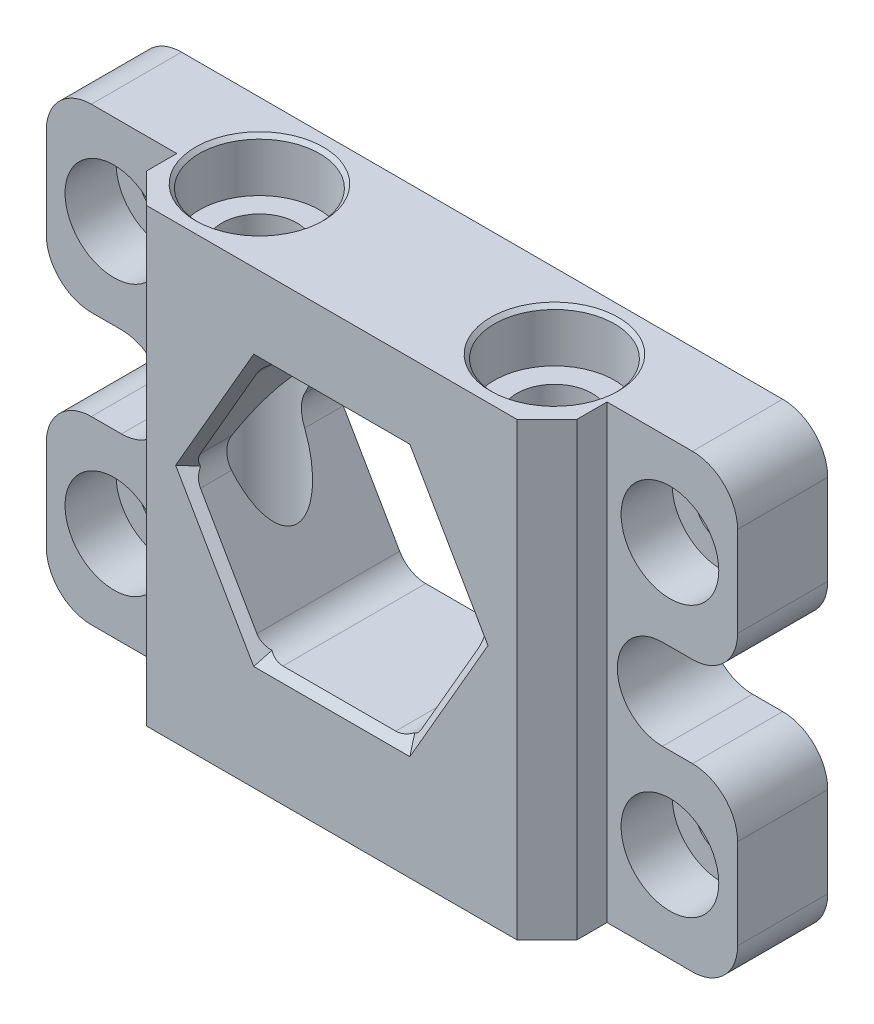
from build123d import *

# Parameters (mm, degrees)
SKETCH1_W                                           = 46
SKETCH1_H                                           = 30
BOSS_EXTRUDE1_DEPTH                                 = 10
CUT_EXTRUDE1_DEPTH                                  = 56.821142948
CBORE_FOR_M5_HEX_SOCKET_HEAD_CAP_SCR_2_COUNT        = 2
CBORE_FOR_M5_HEX_SOCKET_HEAD_CAP_SCR_2_PITCH        = 19.629909152
CBORE_FOR_M3_HEX_SOCKET_HEAD_CAP_SCR_2_COUNT        = 2
CBORE_FOR_M3_HEX_SOCKET_HEAD_CAP_SCR_2_PITCH        = 37
CBORE_FOR_M3_HEX_SOCKET_HEAD_CAP_SCR_3_COUNT        = 2
CBORE_FOR_M3_HEX_SOCKET_HEAD_CAP_SCR_3_PITCH        = 41.146081223
CBORE_FOR_M3_HEX_SOCKET_HEAD_CAP_SCR_4_COUNT        = 2
CBORE_FOR_M3_HEX_SOCKET_HEAD_CAP_SCR_4_PITCH        = 18
TAP_DRILL_FOR_M3_HELICOIL1_D                        = 3.15
TAP_DRILL_FOR_M3_HELICOIL1_DEPTH                    = 24.053644525
TAP_DRILL_FOR_M3_HELICOIL1_CSINK_D                  = 3.2
TAP_DRILL_FOR_M3_HELICOIL1_CSINK_ANGLE              = 90
TAP_DRILL_FOR_M3_HELICOIL1_TIP                      = 0.946355475
CUT_EXTRUDE2_DEPTH                                  = 56.821142948
CUT_EXTRUDE3_DEPTH                                  = 4
CBORE_FOR_M3_HEX_SOCKET_HEAD_CAP_SCREW2_D           = 3.4
CBORE_FOR_M3_HEX_SOCKET_HEAD_CAP_SCREW2_CBORE_D     = 6.5
CBORE_FOR_M3_HEX_SOCKET_HEAD_CAP_SCREW2_CBORE_DEPTH = 3.4
CHAMFER1_SIZE                                       = 2
CHAMFER2_SIZE                                       = 0.5
FILLET2_R                                           = 2
FILLET1_R                                           = 3


with BuildPart() as part:
    # Sketch1 → Boss-Extrude1 (new body)
    with BuildSketch(Plane.XY):
        with Locations((23, 15)):
            Rectangle(SKETCH1_W, SKETCH1_H)
    extrude(amount=BOSS_EXTRUDE1_DEPTH)

    # Sketch2 → Cut-Extrude1 (cut, through all)
    with BuildSketch(Plane.XY.offset(10)):
        Polygon((27.907477288, 24.5), (18.092522712, 24.5), (13.185045424, 16), (18.092522712, 7.5), (27.907477288, 7.5), (32.814954576, 16), align=None)
    extrude(amount=-CUT_EXTRUDE1_DEPTH, mode=Mode.SUBTRACT)

    # Sketch4 → CBORE for M5 Hex Socket Head Cap Screw1 (revolve, cut)
    with BuildSketch(Plane(origin=(13.185045424, 30, 5), x_dir=(0, 0, 1), z_dir=(1, 0, 0))):
        Polygon((0, 0), (0, 27), (2.5, 25.497848452), (2.5, 3.5), (4, 3.5), (4, 0.25), (4.25, 0), align=None)
    cbore_for_m5_hex_socket_head_cap_screw1 = revolve(axis=Axis((13.185045424, 36.35, 5), (0, -1, 0)), mode=Mode.SUBTRACT)

    # CBORE for M5 Hex Socket Head Cap Scr 2: CBORE for M5 Hex Socket Head Cap Screw1 ×2
    with Locations(*[(i * CBORE_FOR_M5_HEX_SOCKET_HEAD_CAP_SCR_2_PITCH, 0, 0) for i in range(1, CBORE_FOR_M5_HEX_SOCKET_HEAD_CAP_SCR_2_COUNT)]):
        add(cbore_for_m5_hex_socket_head_cap_screw1, mode=Mode.SUBTRACT)

    # Sketch6 → CBORE for M3 Hex Socket Head Cap Screw1 (revolve, cut)
    with BuildSketch(Plane(origin=(4.5, 24, 10), x_dir=(0, -1, 0), z_dir=(1, 0, 0))):
        Polygon((0, 0), (0, 10), (1.7, 10), (1.7, 3.4), (3.25, 3.4), (3.25, 0.025), (3.275, 0), align=None)
    cbore_for_m3_hex_socket_head_cap_screw1 = revolve(axis=Axis((4.5, 24, 16.35), (0, 0, -1)), mode=Mode.SUBTRACT)

    # CBORE for M3 Hex Socket Head Cap Scr 2: CBORE for M3 Hex Socket Head Cap Screw1 ×2
    with Locations(*[(i * CBORE_FOR_M3_HEX_SOCKET_HEAD_CAP_SCR_2_PITCH, 0, 0) for i in range(1, CBORE_FOR_M3_HEX_SOCKET_HEAD_CAP_SCR_2_COUNT)]):
        add(cbore_for_m3_hex_socket_head_cap_screw1, mode=Mode.SUBTRACT)

    # CBORE for M3 Hex Socket Head Cap Scr 3: CBORE for M3 Hex Socket Head Cap Screw1 ×2
    with Locations(*[Vector(0.8992350887457975, -0.4374657188493034, 0) * (i * CBORE_FOR_M3_HEX_SOCKET_HEAD_CAP_SCR_3_PITCH) for i in range(1, CBORE_FOR_M3_HEX_SOCKET_HEAD_CAP_SCR_3_COUNT)]):
        add(cbore_for_m3_hex_socket_head_cap_screw1, mode=Mode.SUBTRACT)

    # CBORE for M3 Hex Socket Head Cap Scr 4: CBORE for M3 Hex Socket Head Cap Screw1 ×2
    with Locations(*[(0, -i * CBORE_FOR_M3_HEX_SOCKET_HEAD_CAP_SCR_4_PITCH, 0) for i in range(1, CBORE_FOR_M3_HEX_SOCKET_HEAD_CAP_SCR_4_COUNT)]):
        add(cbore_for_m3_hex_socket_head_cap_screw1, mode=Mode.SUBTRACT)

    # Tap Drill for M3 Helicoil1
    with Locations(Plane(origin=(0, 0, 0), x_dir=(-1, 0, 0), z_dir=(0, -1, 0))):
        with Locations((-13.185045424, -5), (-32.814954576, -5)):
            CounterSinkHole(TAP_DRILL_FOR_M3_HELICOIL1_D / 2, TAP_DRILL_FOR_M3_HELICOIL1_CSINK_D / 2, depth=TAP_DRILL_FOR_M3_HELICOIL1_DEPTH, counter_sink_angle=TAP_DRILL_FOR_M3_HELICOIL1_CSINK_ANGLE)
            with Locations((0, 0, -(TAP_DRILL_FOR_M3_HELICOIL1_DEPTH + TAP_DRILL_FOR_M3_HELICOIL1_TIP / 2))):  # 118° drill point
                Cone(0, TAP_DRILL_FOR_M3_HELICOIL1_D / 2, TAP_DRILL_FOR_M3_HELICOIL1_TIP, mode=Mode.SUBTRACT)

    # Sketch11 → Cut-Extrude2 (cut, through all)
    with BuildSketch(Plane.XY.offset(10)):
        with BuildLine():
            ThreePointArc((5, 12), (8, 15), (5, 18))
            Line((5, 18), (0, 18))
            Line((0, 18), (0, 12))
            Line((0, 12), (5, 12))
        make_face()
        with BuildLine():
            Line((46, 12), (46, 18))
            Line((46, 18), (41, 18))
            ThreePointArc((41, 18), (38, 15), (41, 12))
            Line((41, 12), (46, 12))
        make_face()
    extrude(amount=-CUT_EXTRUDE2_DEPTH, mode=Mode.SUBTRACT)

    # Sketch13 → Cut-Extrude3 (cut)
    with BuildSketch(Plane.XY.offset(10)):
        with BuildLine():
            Line((8.685045424, 0), (8.685045424, 30))
            Line((8.685045424, 30), (0, 30))
            Line((0, 30), (0, 18))
            Line((0, 18), (5, 18))
            ThreePointArc((5, 18), (8, 15), (5, 12))
            Line((5, 12), (0, 12))
            Line((0, 12), (0, 0))
            Line((0, 0), (8.685045424, 0))
        make_face()
        with BuildLine():
            Line((46, 30), (37.314954576, 30))
            Line((37.314954576, 30), (37.314954576, 0))
            Line((37.314954576, 0), (46, 0))
            Line((46, 0), (46, 12))
            Line((46, 12), (41, 12))
            ThreePointArc((41, 12), (38, 15), (41, 18))
            Line((41, 18), (46, 18))
            Line((46, 18), (46, 30))
        make_face()
    extrude(amount=-CUT_EXTRUDE3_DEPTH, mode=Mode.SUBTRACT)

    # CBORE for M3 Hex Socket Head Cap Screw2 (through all)
    with Locations(Plane.XY.offset(6)):
        with Locations((4.5, 24), (4.5, 6), (41.5, 24), (41.5, 6)):
            CounterBoreHole(CBORE_FOR_M3_HEX_SOCKET_HEAD_CAP_SCREW2_D / 2, CBORE_FOR_M3_HEX_SOCKET_HEAD_CAP_SCREW2_CBORE_D / 2, CBORE_FOR_M3_HEX_SOCKET_HEAD_CAP_SCREW2_CBORE_DEPTH)

    # Chamfer1
    chamfer1_edges = [part.edges().sort_by_distance(p)[0] for p in [
        (8.685045424, 15, 10),
        (37.314954576, 15, 10),
    ]]
    chamfer(chamfer1_edges, length=CHAMFER1_SIZE)

    # Chamfer2
    chamfer2_edges = [part.edges().sort_by_distance(p)[0] for p in [
        (30.361215932, 20.25, 10),
        (23, 24.5, 10),
        (15.638784068, 20.25, 10),
        (15.638784068, 11.75, 10),
        (23, 7.5, 10),
        (30.361215932, 11.75, 10),
    ]]
    chamfer(chamfer2_edges, length=CHAMFER2_SIZE)

    # Fillet2
    fillet2_edges = [part.edges().sort_by_distance(p)[0] for p in [
        (32.814954576, 16, 8.5),
        (32.814954576, 16, 1.25),
        (27.907477288, 7.5, 4.75),
        (18.092522712, 7.5, 4.75),
        (13.185045424, 16, 1.25),
        (13.185045424, 16, 8.5),
        (18.092522712, 24.5, 4.75),
        (27.907477288, 24.5, 4.75),
    ]]
    fillet(fillet2_edges, radius=FILLET2_R)

    # Fillet1
    fillet1_edges = [part.edges().sort_by_distance(p)[0] for p in [
        (0, 12, 3),
        (0, 18, 3),
        (46, 18, 3),
        (46, 12, 3),
        (0, 30, 3),
        (46, 30, 3),
        (46, 0, 3),
        (0, 0, 3),
    ]]
    fillet(fillet1_edges, radius=FILLET1_R)


solid = part.part
